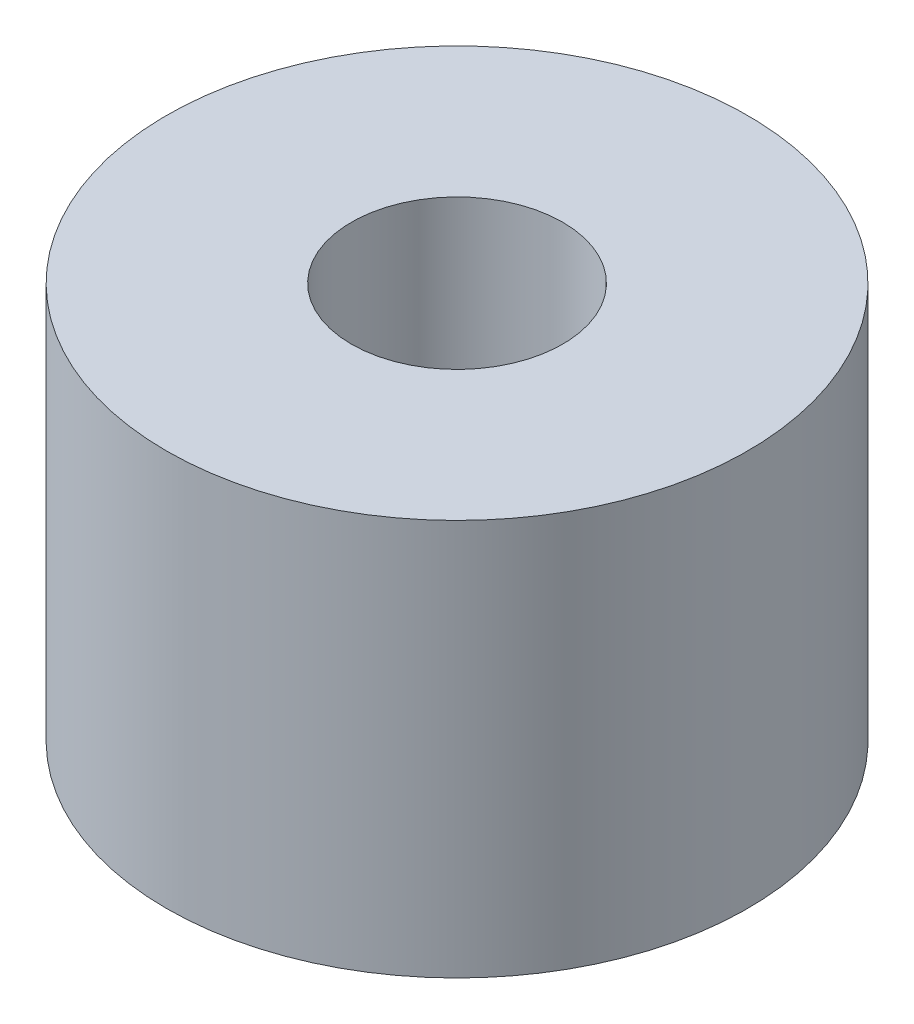
from build123d import *

# Parameters (mm, degrees)
SZKIC1_R                    = 11
DODANIE_WYCI_GNI_CIE1_DEPTH = 15
OTWORY_USTALAJ_CE_8_0MM1_D  = 8


with BuildPart() as part:
    # Szkic1 → Dodanie-wyciągnięcie1 (new body)
    with BuildSketch(Plane(origin=(0, 0, 0), x_dir=(1, 0, 0), z_dir=(0, 1, 0))):
        with Locations(Location((0, 0, 0), (0, 0, 270))):
            Circle(SZKIC1_R)
    extrude(amount=DODANIE_WYCI_GNI_CIE1_DEPTH)

    # Otwory ustalające Ø8.0mm1 (through all)
    with Locations(Plane(origin=(0, 15, 0), x_dir=(1, 0, 0), z_dir=(0, 1, 0))):
        with Locations((0, 0)):
            Hole(OTWORY_USTALAJ_CE_8_0MM1_D / 2)


solid = part.part
